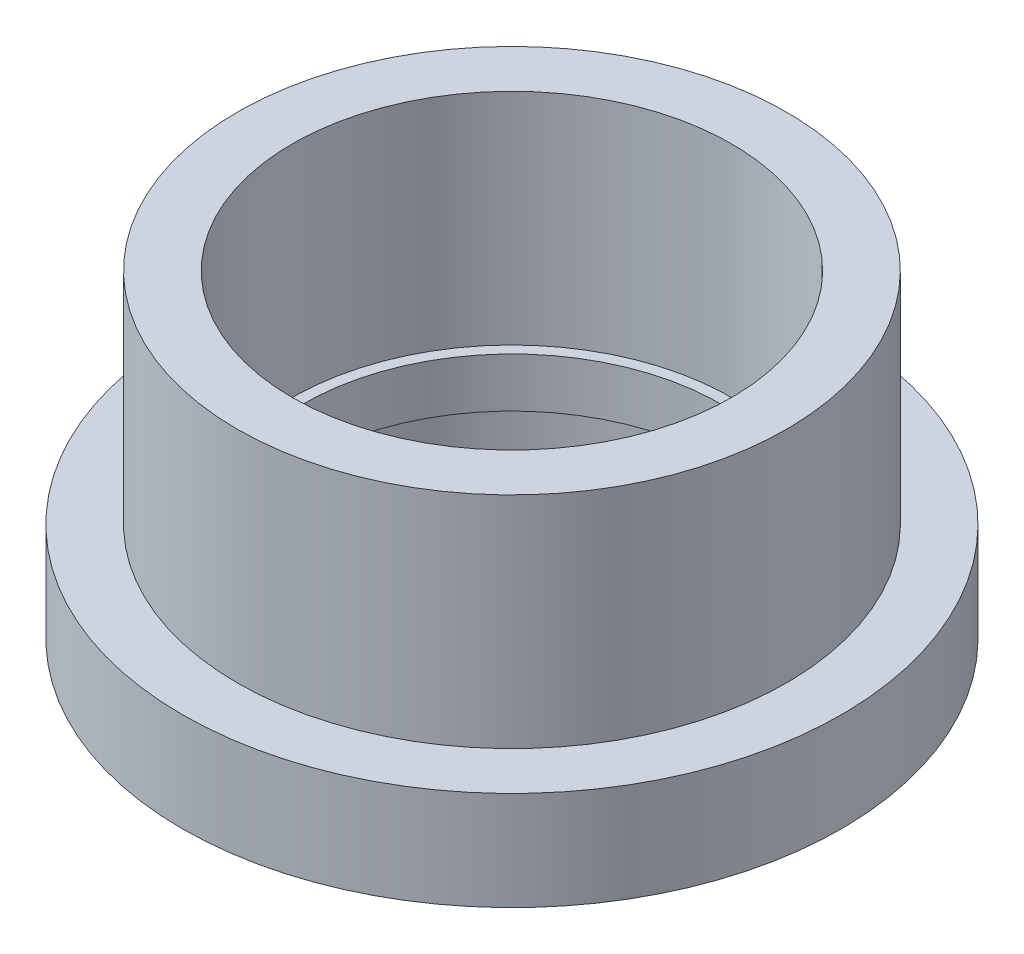
from build123d import *

# Parameters (mm, degrees)
SKETCH3_R           = 1.6
CUT_EXTRUDE1_DEPTH  = 10
SKETCH4_R           = 50
SKETCH4_R_2         = 40
BOSS_EXTRUDE1_DEPTH = 40


with BuildPart() as part:
    # Sketch1 → Revolve1 (revolve)
    with BuildSketch(Plane.XY, mode=Mode.PRIVATE) as revolve1_sk:
        Polygon((38, 0), (38, 9), (60, 9), (60, -9), (40.25, -9), (40.25, 0), align=None)
    revolve(revolve1_sk.sketch.rotate(Axis((0, 83.520836207, 0), (0, -1, 0)), 90), axis=Axis((0, 83.520836207, 0), (0, -1, 0)))

    # Sketch3 → Cut-Extrude1 (cut)
    with BuildSketch(Plane.XZ.offset(9)):
        with Locations(Location((0, 45.125, 0), (0, 0, 270))):
            Circle(SKETCH3_R)
        with Locations(Location((45.125, 0, 0), (0, 0, 270))):
            Circle(SKETCH3_R)
        with Locations(Location((0, -45.125, 0), (0, 0, 270))):
            Circle(SKETCH3_R)
        with Locations(Location((-45.125, 0, 0), (0, 0, 270))):
            Circle(SKETCH3_R)
    extrude(amount=-CUT_EXTRUDE1_DEPTH, mode=Mode.SUBTRACT)

    # Sketch4 → Boss-Extrude1 (add)
    with BuildSketch(Plane(origin=(0, 9, 0), x_dir=(1, 0, 0), z_dir=(0, 1, 0))):
        with Locations(Location((0, 0, 0), (0, 0, 270))):
            Circle(SKETCH4_R)
        with Locations(Location((0, 0, 0), (0, 0, 270))):
            Circle(SKETCH4_R_2, mode=Mode.SUBTRACT)
    extrude(amount=BOSS_EXTRUDE1_DEPTH)


solid = part.part
